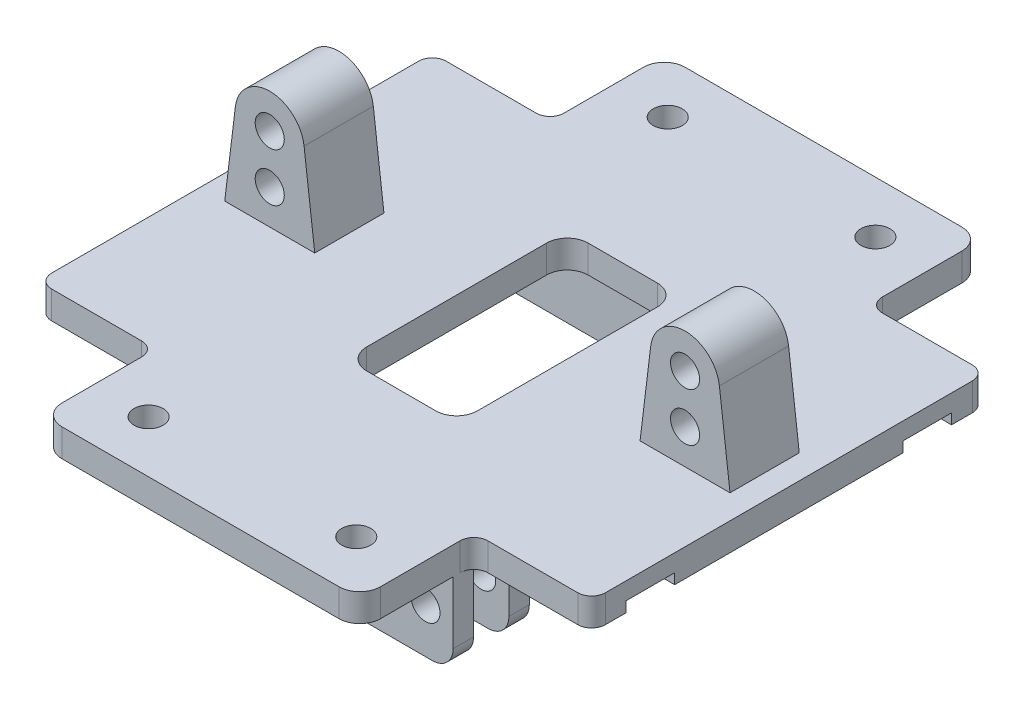
from build123d import *

# Parameters (mm, degrees)
EXTRUDE_1_DEPTH          = 4
SKETCH_2_W               = 80
SKETCH_2_H               = 57
EXTRUDE_2_DEPTH          = 4
FILLET_1_R               = 2
SKETCH_3_R               = 2.1
CUT_EXTRUDE_1_DEPTH      = 61.340699366
SKETCH_4_R               = 2.1
EXTRUDE_3_DEPTH          = 5
SKETCH_5_W               = 46
SKETCH_5_H               = 2.95
EXTRUDE_4_DEPTH          = 12
CUT_EXTRUDE_2_DEPTH      = 89.843964342
CUT_EXTRUDE_2_DEPTH_BACK = 89.843964342
SKETCH_6_R               = 2.1
FILLET_2_R               = 3
SKETCH_7_W               = 7
SKETCH_7_H               = 1.5
CUT_EXTRUDE_3_DEPTH      = 15
MIRROR_3_COPY_1_SKETCH_W = 7
MIRROR_3_COPY_1_SKETCH_H = 1.5
MIRROR_3_COPY_1_DEPTH    = 15
CUT_EXTRUDE_4_DEPTH      = 10


with BuildPart() as part:
    # 草图1 → 凸台-拉伸1 (new body)
    with BuildSketch(Plane(origin=(0, 0, 0), x_dir=(1, 0, 0), z_dir=(0, 1, 0))):
        with BuildLine():
            Line((-20, -45), (20, -45))
            ThreePointArc((20, -45), (22.121320344, -44.121320344), (23, -42))
            Line((23, -42), (23, 42))
            ThreePointArc((23, 42), (22.121320344, 44.121320344), (20, 45))
            Line((20, 45), (-20, 45))
            ThreePointArc((-20, 45), (-22.121320344, 44.121320344), (-23, 42))
            Line((-23, 42), (-23, -42))
            ThreePointArc((-23, -42), (-22.121320344, -44.121320344), (-20, -45))
        make_face()
    extrude(amount=EXTRUDE_1_DEPTH)

    # 草图2 → 凸台-拉伸2 (add)
    with BuildSketch(Plane(origin=(0, 4, 0), x_dir=(1, 0, 0), z_dir=(0, 1, 0))):
        Rectangle(SKETCH_2_W, SKETCH_2_H)
    extrude(amount=-EXTRUDE_2_DEPTH)

    # 圆角1
    fillet_1_edges = [part.edges().sort_by_distance(p)[0] for p in [
        (40, 2, 28.5),
        (-40, 2, -28.5),
        (40, 2, -28.5),
        (23, 2, 28.5),
        (-23, 2, 28.5),
        (-40, 2, 28.5),
        (23, 2, -28.5),
        (-23, 2, -28.5),
    ]]
    fillet(fillet_1_edges, radius=FILLET_1_R)

    # 草图3 → 切除-拉伸1 (cut, through all)
    with BuildSketch(Plane(origin=(0, 4, 0), x_dir=(1, 0, 0), z_dir=(0, 1, 0))):
        with Locations(Location((15, -37.5, 0), (0, 0, 270))):
            Circle(SKETCH_3_R)
        with Locations(Location((-15, -37.5, 0), (0, 0, 270))):
            Circle(SKETCH_3_R)
        with Locations(Location((-15, 37.5, 0), (0, 0, 270))):
            Circle(SKETCH_3_R)
        with Locations(Location((15, 37.5, 0), (0, 0, 270))):
            Circle(SKETCH_3_R)
    extrude(amount=-CUT_EXTRUDE_1_DEPTH, mode=Mode.SUBTRACT)

    # 草图4 → 凸台-拉伸3 (add, symmetric)
    # profile 1 of 2: a face of its own
    with BuildSketch(Plane.XY):
        with BuildLine():
            ThreePointArc((-25.036748961, 16.605094313), (-30, 21), (-34.963251039, 16.605094313))
            Line((-34.963251039, 16.605094313), (-36.5, 4))
            Line((-36.5, 4), (-23.5, 4))
            Line((-23.5, 4), (-25.036748961, 16.605094313))
        make_face()
        with Locations((-30, 9)):
            Circle(SKETCH_4_R, mode=Mode.SUBTRACT)
        with Locations((-30, 16)):
            Circle(SKETCH_4_R, mode=Mode.SUBTRACT)
    # profile 2 of 2: a face of its own
    with BuildSketch(Plane.XY):
        with BuildLine():
            ThreePointArc((34.963251039, 16.605094313), (30, 21), (25.036748961, 16.605094313))
            Line((25.036748961, 16.605094313), (23.5, 4))
            Line((23.5, 4), (36.5, 4))
            Line((36.5, 4), (34.963251039, 16.605094313))
        make_face()
        with Locations((30, 9)):
            Circle(SKETCH_4_R, mode=Mode.SUBTRACT)
        with Locations((30, 16)):
            Circle(SKETCH_4_R, mode=Mode.SUBTRACT)
    extrude(amount=EXTRUDE_3_DEPTH, both=True)

    # 草图5 → 凸台-拉伸4 (add)
    with BuildSketch(Plane.XZ):
        Polygon((23, 31.5), (-23, 31.5), (-23, 30.5), (-23, 28.55), (23, 28.55), (23, 30.5), align=None)
        with Locations((0, 21.975)):
            Rectangle(SKETCH_5_W, SKETCH_5_H)
    extrude_4 = extrude(amount=EXTRUDE_4_DEPTH)

    # 镜向1: 凸台-拉伸4 across plane
    add(extrude_4.mirror(Plane.XY))

    # 草图6 → 切除-拉伸2 (cut, two sides: drawn at the far end of the back side and taken through both)
    with BuildSketch(Plane.XY.offset(31.5).offset(-CUT_EXTRUDE_2_DEPTH_BACK)):
        with Locations((19, -5.5)):
            Circle(SKETCH_6_R)
        with Locations((-19, -5.5)):
            Circle(SKETCH_6_R)
    extrude(amount=CUT_EXTRUDE_2_DEPTH + CUT_EXTRUDE_2_DEPTH_BACK, mode=Mode.SUBTRACT)

    # 圆角2
    fillet_2_edges = [part.edges().sort_by_distance(p)[0] for p in [
        (23, -12, 30.025),
        (-23, -12, 30.025),
        (23, -12, 21.975),
        (-23, -12, 21.975),
        (-23, -12, -30.025),
        (23, -12, -30.025),
        (-23, -12, -21.975),
        (23, -12, -21.975),
    ]]
    fillet(fillet_2_edges, radius=FILLET_2_R)

    # 草图7 → 切除-拉伸3 (cut)
    with BuildSketch(Plane.ZY.offset(40)):
        with Locations((-20, 0.75)):
            Rectangle(SKETCH_7_W, SKETCH_7_H)
    cut_extrude_3 = extrude(amount=-CUT_EXTRUDE_3_DEPTH, mode=Mode.SUBTRACT)

    # 镜向2: 切除-拉伸3 across plane
    add(cut_extrude_3.mirror(Plane.XY), mode=Mode.SUBTRACT)

    # 镜向3: 切除-拉伸3 across plane
    add(cut_extrude_3.mirror(Plane(origin=(0, 0, 0), x_dir=(0, 0, 1), z_dir=(1, 0, 0))), mode=Mode.SUBTRACT)

    # 镜向3 copy 1 sketch → 镜向3 copy 1 (cut)
    with BuildSketch(Plane(origin=(40, 0, 0), x_dir=(0, 0, -1), z_dir=(1, 0, 0))):
        with Locations((-20, 0.75)):
            Rectangle(MIRROR_3_COPY_1_SKETCH_W, MIRROR_3_COPY_1_SKETCH_H)
    extrude(amount=-MIRROR_3_COPY_1_DEPTH, mode=Mode.SUBTRACT)

    # 草图8 → 切除-拉伸4 (cut)
    with BuildSketch(Plane(origin=(0, 4, 0), x_dir=(1, 0, 0), z_dir=(0, 1, 0))):
        with BuildLine():
            Line((-5, -16), (5, -16))
            ThreePointArc((5, -16), (7.121320344, -15.121320344), (8, -13))
            Line((8, -13), (8, 13))
            ThreePointArc((8, 13), (7.121320344, 15.121320344), (5, 16))
            Line((5, 16), (-5, 16))
            ThreePointArc((-5, 16), (-7.121320344, 15.121320344), (-8, 13))
            Line((-8, 13), (-8, -13))
            ThreePointArc((-8, -13), (-7.121320344, -15.121320344), (-5, -16))
        make_face()
    extrude(amount=-CUT_EXTRUDE_4_DEPTH, mode=Mode.SUBTRACT)


solid = part.part
